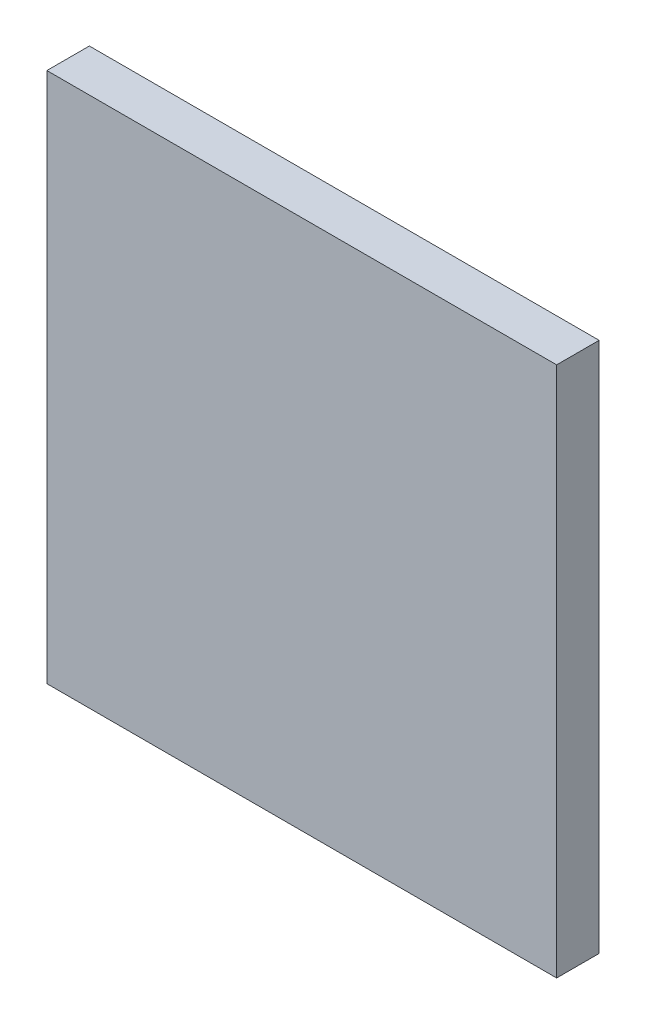
from build123d import *

# Parameters (mm, degrees)
SKETCH1_W           = 12
SKETCH1_H           = 12.5
BOSS_EXTRUDE1_DEPTH = 1


with BuildPart() as part:
    # Sketch1 → Boss-Extrude1 (new body)
    with BuildSketch(Plane.XY):
        with Locations((6, 6.25)):
            Rectangle(SKETCH1_W, SKETCH1_H)
    extrude(amount=BOSS_EXTRUDE1_DEPTH)


solid = part.part
